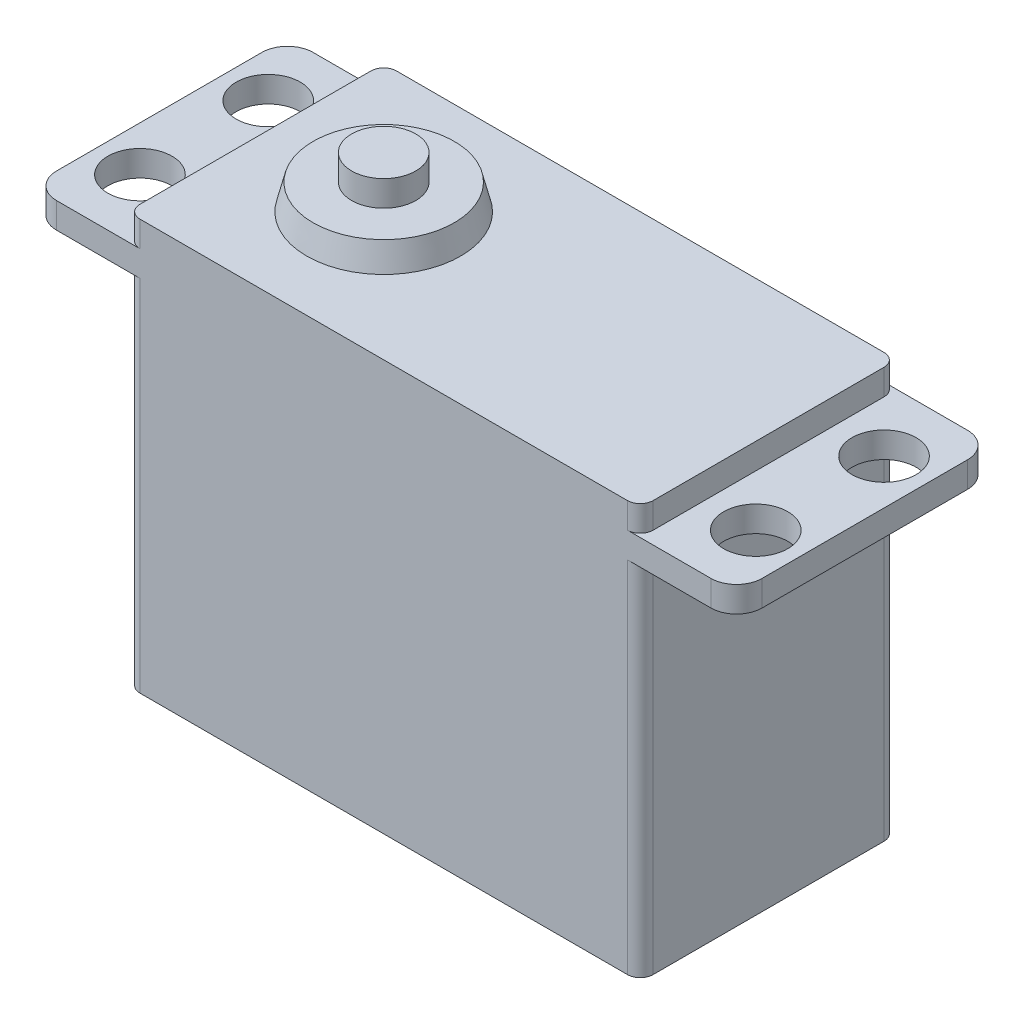
from build123d import *

# Parameters (mm, degrees)
SKETCH1_W           = 55
SKETCH1_H           = 20
SKETCH1_R           = 2.5
BOSS_EXTRUDE1_DEPTH = 2
FILLET1_R           = 2
SKETCH2_W           = 40
SKETCH2_H           = 20
BOSS_EXTRUDE2_DEPTH = 28
SKETCH3_W           = 40
SKETCH3_H           = 20
BOSS_EXTRUDE3_DEPTH = 2
FILLET2_R           = 1


with BuildPart() as part:
    # Sketch1 → Boss-Extrude1 (new body)
    with BuildSketch(Plane(origin=(0, 0, 0), x_dir=(1, 0, 0), z_dir=(0, 1, 0))):
        with Locations((27.5, 10)):
            Rectangle(SKETCH1_W, SKETCH1_H)
        with Locations(Location((3.5, 15, 0), (0, 0, 270))):
            Circle(SKETCH1_R, mode=Mode.SUBTRACT)
        with Locations(Location((3.5, 5, 0), (0, 0, 270))):
            Circle(SKETCH1_R, mode=Mode.SUBTRACT)
        with Locations(Location((51.5, 15, 0), (0, 0, 270))):
            Circle(SKETCH1_R, mode=Mode.SUBTRACT)
        with Locations(Location((51.5, 5, 0), (0, 0, 270))):
            Circle(SKETCH1_R, mode=Mode.SUBTRACT)
    extrude(amount=BOSS_EXTRUDE1_DEPTH)

    # Fillet1
    fillet1_edges = [part.edges().sort_by_distance(p)[0] for p in [
        (0, 1, -20),
        (55, 1, -20),
        (55, 1, 0),
        (0, 1, 0),
    ]]
    fillet(fillet1_edges, radius=FILLET1_R)

    # Sketch2 → Boss-Extrude2 (add)
    with BuildSketch(Plane.XZ):
        with Locations((27.5, -10)):
            Rectangle(SKETCH2_W, SKETCH2_H)
    extrude(amount=BOSS_EXTRUDE2_DEPTH)

    # Sketch3 → Boss-Extrude3 (add)
    with BuildSketch(Plane(origin=(0, 2, 0), x_dir=(1, 0, 0), z_dir=(0, 1, 0))):
        with Locations((27.5, 10)):
            Rectangle(SKETCH3_W, SKETCH3_H)
    extrude(amount=BOSS_EXTRUDE3_DEPTH)

    # Fillet2
    fillet2_edges = [part.edges().sort_by_distance(p)[0] for p in [
        (7.5, -14, 0),
        (7.5, -14, -20),
        (47.5, -14, -20),
        (47.5, -14, 0),
        (7.5, 3, -20),
        (7.5, 3, 0),
        (47.5, 3, 0),
        (47.5, 3, -20),
    ]]
    fillet(fillet2_edges, radius=FILLET2_R)

    # Sketch4 → Revolve1 (revolve)
    with BuildSketch(Plane.XY.offset(-10), mode=Mode.PRIVATE) as revolve1_sk:
        Polygon((17.5, 4), (11.5, 4), (12, 6), (15, 6), (15, 8), (17.5, 8), align=None)
    revolve(revolve1_sk.sketch.rotate(Axis((17.5, 8, -10), (0, -1, 0)), 270), axis=Axis((17.5, 8, -10), (0, -1, 0)))


solid = part.part
